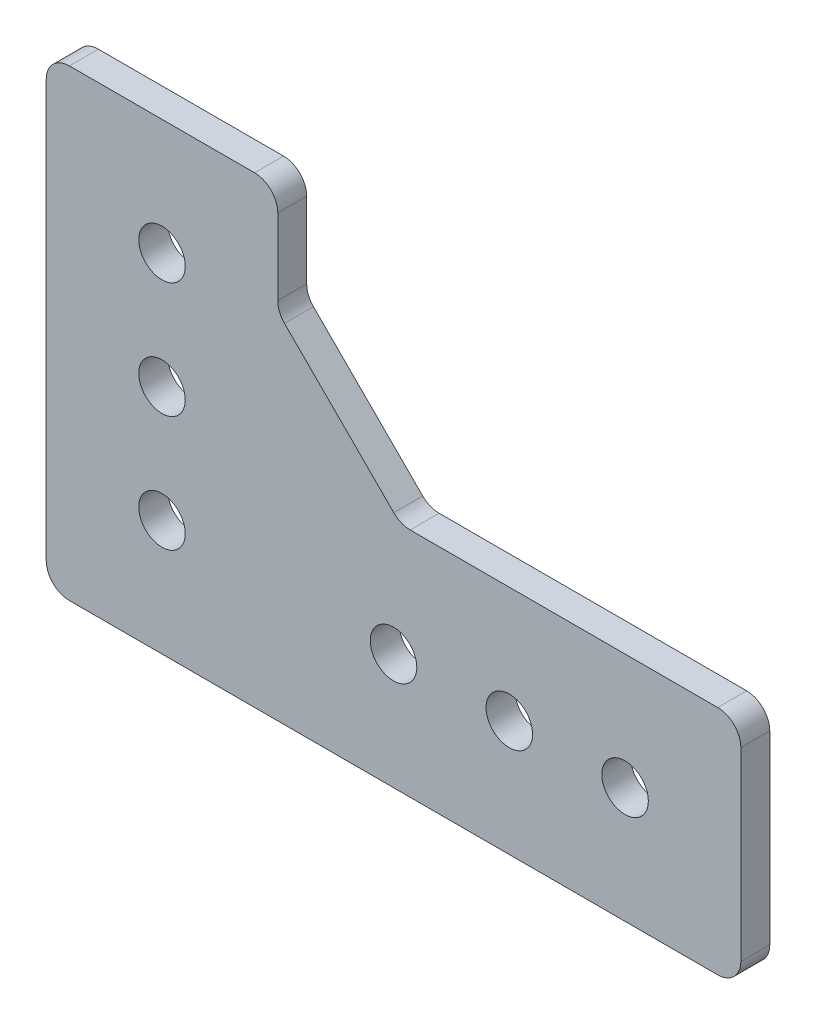
from build123d import *

# Parameters (mm, degrees)
BOSS_EXTRUDE1_DEPTH    = 3.175
F_10_CLEARANCE_HOLE1_D = 5.1054
FILLET1_R              = 2.54


with BuildPart() as part:
    # Sketch1 → Boss-Extrude1 (new body)
    with BuildSketch(Plane.XY):
        Polygon((0, 0), (-76.2, 0), (-76.2, 50.8), (-50.8, 50.8), (-50.8, 38.870384182), (-37.329615818, 25.4), (0, 25.4), align=None)
    extrude(amount=BOSS_EXTRUDE1_DEPTH)

    # #10 Clearance Hole1 (through all)
    with Locations(Plane.XY.offset(3.175)):
        with Locations((-63.5, 38.1), (-63.5, 25.4), (-63.5, 12.7), (-38.1, 12.7), (-25.4, 12.7), (-12.7, 12.7)):
            Hole(F_10_CLEARANCE_HOLE1_D / 2)

    # Fillet1
    fillet1_edges = [part.edges().sort_by_distance(p)[0] for p in [
        (-37.329615818, 25.4, 1.5875),
        (0, 25.4, 1.5875),
        (0, 0, 1.5875),
        (-76.2, 0, 1.5875),
        (-76.2, 50.8, 1.5875),
        (-50.8, 50.8, 1.5875),
        (-50.8, 38.870384182, 1.5875),
    ]]
    fillet(fillet1_edges, radius=FILLET1_R)


solid = part.part
